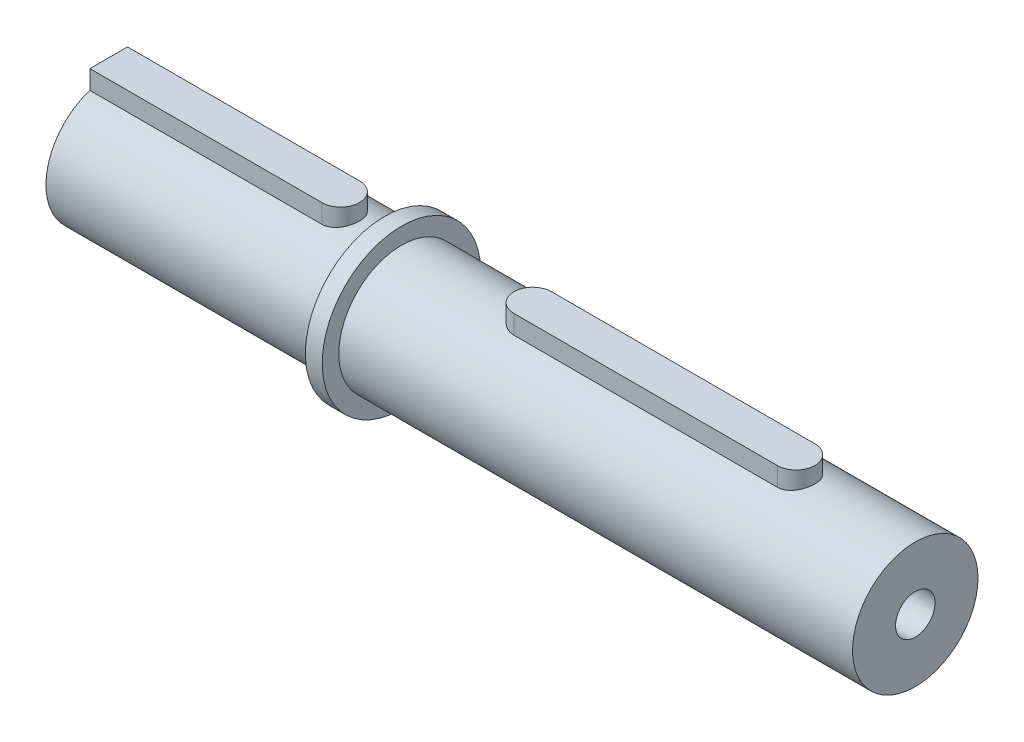
from build123d import *

# Parameters (mm, degrees)
SKETCH1_R             = 10.033
BOSS_EXTRUDE1_DEPTH   = 2.1336
SKETCH2_R             = 7.9375
BOSS_EXTRUDE2_DEPTH   = 65.024
M6_TAPPED_HOLE1_D     = 5
M6_TAPPED_HOLE1_DEPTH = 14.986
M6_TAPPED_HOLE1_TIP   = 1.502151548
BOSS_EXTRUDE3_START   = 34.925
SKETCH5_R             = 7.9375
BOSS_EXTRUDE3_DEPTH   = 34.925
BOSS_EXTRUDE4_DEPTH   = 4.7625


with BuildPart() as part:
    # Sketch1 → Boss-Extrude1 (new body)
    with BuildSketch(Plane(origin=(0, 0, 0), x_dir=(0, 0, -1), z_dir=(1, 0, 0))):
        Circle(SKETCH1_R)
    extrude(amount=-BOSS_EXTRUDE1_DEPTH)

    # Sketch2 → Boss-Extrude2 (add)
    with BuildSketch(Plane(origin=(0, 0, 0), x_dir=(0, 0, -1), z_dir=(1, 0, 0))):
        Circle(SKETCH2_R)
    extrude(amount=BOSS_EXTRUDE2_DEPTH)

    # M6 Tapped Hole1
    with Locations(Plane(origin=(65.024, 0, 0), x_dir=(0, 0, -1), z_dir=(1, 0, 0))):
        with Locations((0, 0)):
            Hole(M6_TAPPED_HOLE1_D / 2, depth=M6_TAPPED_HOLE1_DEPTH)
            with Locations((0, 0, -(M6_TAPPED_HOLE1_DEPTH + M6_TAPPED_HOLE1_TIP / 2))):  # 118° drill point
                Cone(0, M6_TAPPED_HOLE1_D / 2, M6_TAPPED_HOLE1_TIP, mode=Mode.SUBTRACT)

    # Sketch5 → Boss-Extrude3 (add)
    with BuildSketch(Plane.ZY.offset(2.1336).offset(BOSS_EXTRUDE3_START)):
        with Locations(Location((0, 0, 0), (0, 0, 180))):
            Circle(SKETCH5_R)
    extrude(amount=-BOSS_EXTRUDE3_DEPTH)

    # Sketch7 → Boss-Extrude4 (add)
    with BuildSketch(Plane(origin=(0, 5.1943, 0), x_dir=(1, 0, 0), z_dir=(0, 1, 0))):
        with BuildLine():
            Line((16.60525, 2.38125), (49.94275, 2.38125))
            ThreePointArc((49.94275, 2.38125), (52.324, 0), (49.94275, -2.38125))
            Line((49.94275, -2.38125), (16.60525, -2.38125))
            ThreePointArc((16.60525, -2.38125), (14.224, 0), (16.60525, 2.38125))
        make_face()
        with BuildLine():
            Line((-37.0586, 2.38125), (-7.68985, 2.38125))
            ThreePointArc((-7.68985, 2.38125), (-5.3086, 0), (-7.68985, -2.38125))
            Line((-7.68985, -2.38125), (-37.0586, -2.38125))
            Line((-37.0586, -2.38125), (-37.0586, 2.38125))
        make_face()
    extrude(amount=BOSS_EXTRUDE4_DEPTH)


solid = part.part
